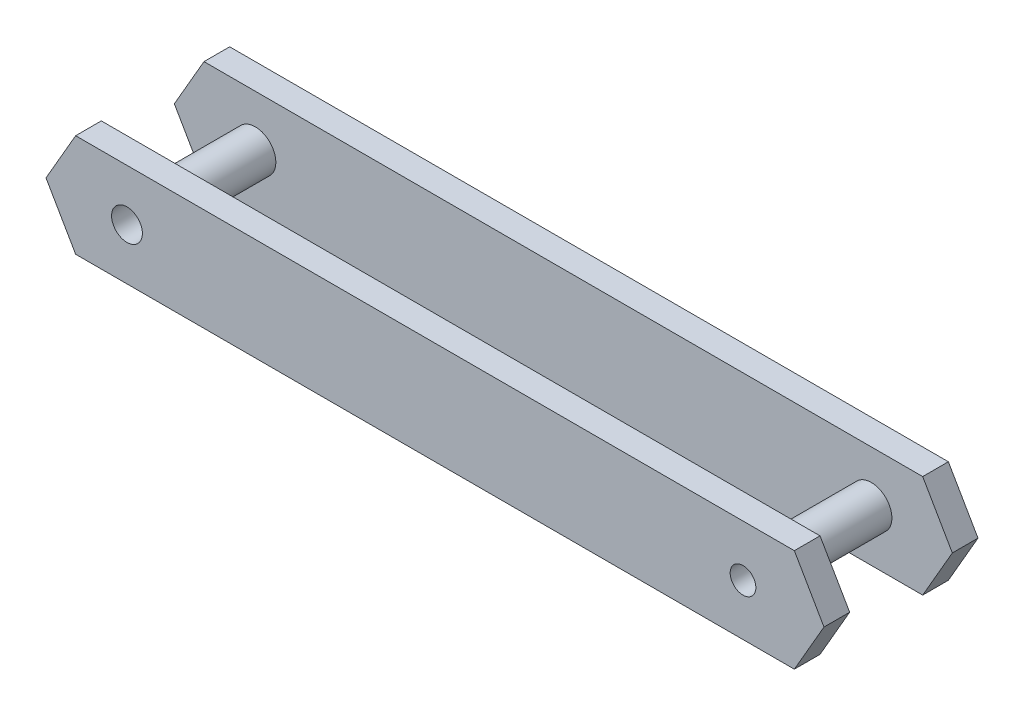
from build123d import *

# Parameters (mm, degrees)
SKETCH1_R             = 20
BOSS_EXTRUDE1_DEPTH   = 50
BOSS_EXTRUDE1_2_DEPTH = 50
BOSS_EXTRUDE2_DEPTH   = 25
SKETCH3_R             = 15
CUT_EXTRUDE1_DEPTH    = 698.037374056
SKETCH4_R             = 12.5
CUT_EXTRUDE2_DEPTH    = 698.037374056


with BuildPart() as part:
    # Sketch1 → Boss-Extrude1 (new, symmetric)
    with BuildSketch(Plane.XY):
        Circle(SKETCH1_R)
    extrude(amount=BOSS_EXTRUDE1_DEPTH, both=True)


with BuildPart() as body_2:
    # Sketch1 → Boss-Extrude1 2 (new, symmetric)
    with BuildSketch(Plane.XY):
        with Locations((600, 0)):
            Circle(SKETCH1_R)
    extrude(amount=BOSS_EXTRUDE1_2_DEPTH, both=True)


with BuildPart() as body_3:
    # Sketch2 → Boss-Extrude2 (new body)
    with BuildSketch(Plane.XY.offset(50)):
        Polygon((-50, 50), (-78.867513459, 0), (-50, -50), (650, -50), (678.867513459, 0), (650, 50), align=None)
    extrude(amount=BOSS_EXTRUDE2_DEPTH)


with BuildPart() as body_4:
    # Mirror1: mirrored copy
    add(body_3.part.mirror(Plane.XY))


with BuildPart() as cut_extrude1_tool:
    # Sketch3 → Cut-Extrude1 (new, through all)
    with BuildSketch(Plane.XY.offset(75)):
        Circle(SKETCH3_R)
        with Locations((700, 0)):
            Circle(SKETCH3_R)
    extrude(amount=-CUT_EXTRUDE1_DEPTH)


with BuildPart() as part_1:
    add(part.part)

    # Cut-Extrude1: cut by cut_extrude1_tool
    add(cut_extrude1_tool.part, mode=Mode.SUBTRACT)


with BuildPart() as body_3_1:
    add(body_3.part)

    # Cut-Extrude1: cut by cut_extrude1_tool
    add(cut_extrude1_tool.part, mode=Mode.SUBTRACT)


with BuildPart() as body_4_1:
    add(body_4.part)

    # Cut-Extrude1: cut by cut_extrude1_tool
    add(cut_extrude1_tool.part, mode=Mode.SUBTRACT)


with BuildPart() as cut_extrude2_tool:
    # Sketch4 → Cut-Extrude2 (new, through all)
    with BuildSketch(Plane.XY.offset(75)):
        with Locations((600, 0)):
            Circle(SKETCH4_R)
    extrude(amount=-CUT_EXTRUDE2_DEPTH)


with BuildPart() as body_2_1:
    add(body_2.part)

    # Cut-Extrude2: cut by cut_extrude2_tool
    add(cut_extrude2_tool.part, mode=Mode.SUBTRACT)


with BuildPart() as body_3_2:
    add(body_3_1.part)

    # Cut-Extrude2: cut by cut_extrude2_tool
    add(cut_extrude2_tool.part, mode=Mode.SUBTRACT)


with BuildPart() as body_4_2:
    add(body_4_1.part)

    # Cut-Extrude2: cut by cut_extrude2_tool
    add(cut_extrude2_tool.part, mode=Mode.SUBTRACT)


solid = Compound([part_1.part, body_2_1.part, body_3_2.part, body_4_2.part])
